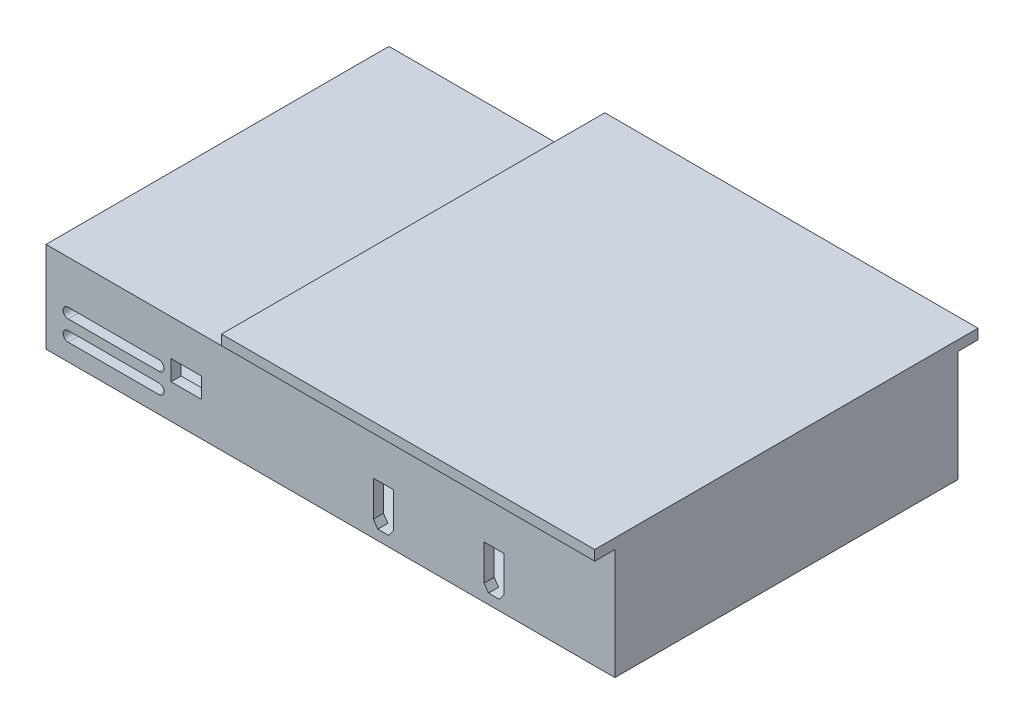
from build123d import *

# Parameters (mm, degrees)
SKETCH1_W           = 282
SKETCH1_H           = 170
BOSS_EXTRUDE1_DEPTH = 60
CUT_EXTRUDE4_DEPTH  = 5
SKETCH8_W           = 160
SKETCH8_H           = 50
CUT_EXTRUDE5_DEPTH  = 279
CUT_EXTRUDE6_DEPTH  = 5
SKETCH10_R          = 5
CUT_EXTRUDE7_DEPTH  = 5
CUT_EXTRUDE8_DEPTH  = 5
CUT_EXTRUDE9_START  = -5
CUT_EXTRUDE9_DEPTH  = 5
SKETCH14_W          = 185
SKETCH14_H          = 5
BOSS_EXTRUDE2_DEPTH = 10
SKETCH15_W          = 185
SKETCH15_H          = 5
BOSS_EXTRUDE3_DEPTH = 10
SKETCH16_W          = 97
SKETCH16_H          = 15
CUT_EXTRUDE10_DEPTH = 170
BOSS_EXTRUDE4_DEPTH = 160
SKETCH18_W          = 15
SKETCH18_H          = 10
CUT_EXTRUDE11_DEPTH = 340.888216918
BOSS_EXTRUDE5_REACH = 339.267
SKETCH19_W          = 5
SKETCH19_H          = 50


with BuildPart() as part:
    # Sketch1 → Boss-Extrude1 (new body)
    with BuildSketch(Plane(origin=(0, 0, 0), x_dir=(1, 0, 0), z_dir=(0, 1, 0))):
        with Locations((141, 85)):
            Rectangle(SKETCH1_W, SKETCH1_H)
    extrude(amount=BOSS_EXTRUDE1_DEPTH)

    # Sketch7 → Cut-Extrude4 (cut)
    with BuildSketch(Plane.XZ):
        with BuildLine():
            Line((13.5, -37.5), (13.5, -132.5))
            ThreePointArc((13.5, -132.5), (11, -135), (8.5, -132.5))
            Line((8.5, -132.5), (8.5, -37.5))
            ThreePointArc((8.5, -37.5), (11, -35), (13.5, -37.5))
        make_face()
        with BuildLine():
            Line((58.5, -37.5), (58.5, -132.5))
            ThreePointArc((58.5, -132.5), (56, -135), (53.5, -132.5))
            Line((53.5, -132.5), (53.5, -37.5))
            ThreePointArc((53.5, -37.5), (56, -35), (58.5, -37.5))
        make_face()
        with BuildLine():
            Line((28.5, -37.5), (28.5, -132.5))
            ThreePointArc((28.5, -132.5), (26, -135), (23.5, -132.5))
            Line((23.5, -132.5), (23.5, -37.5))
            ThreePointArc((23.5, -37.5), (26, -35), (28.5, -37.5))
        make_face()
        with BuildLine():
            Line((43.5, -37.5), (43.5, -132.5))
            ThreePointArc((43.5, -132.5), (41, -135), (38.5, -132.5))
            Line((38.5, -132.5), (38.5, -37.5))
            ThreePointArc((38.5, -37.5), (41, -35), (43.5, -37.5))
        make_face()
    extrude(amount=-CUT_EXTRUDE4_DEPTH, mode=Mode.SUBTRACT)

    # Sketch8 → Cut-Extrude5 (cut)
    with BuildSketch(Plane(origin=(282, 0, 0), x_dir=(0, 0, -1), z_dir=(1, 0, 0))):
        with Locations((85, 30)):
            Rectangle(SKETCH8_W, SKETCH8_H)
    extrude(amount=-CUT_EXTRUDE5_DEPTH, mode=Mode.SUBTRACT)

    # Sketch9 → Cut-Extrude6 (cut)
    with BuildSketch(Plane.XY):
        Polygon((217.15, 25.8), (227.05, 25.8), (227.05, 8.15), (224.8, 5), (219.4, 5), (217.15, 8.15), align=None)
        Polygon((162.25, 25.8), (172.15, 25.8), (172.15, 8.15), (169.9, 5), (164.5, 5), (162.25, 8.15), align=None)
    extrude(amount=-CUT_EXTRUDE6_DEPTH, mode=Mode.SUBTRACT)

    # Sketch10 → Cut-Extrude7 (cut)
    with BuildSketch(Plane.ZY):
        with Locations((-129.202249563, 20)):
            Circle(SKETCH10_R)
        with Locations((-114.202249563, 20)):
            Circle(SKETCH10_R)
        with Locations((-99.202249563, 20)):
            Circle(SKETCH10_R)
        with Locations((-43.390057257, 20)):
            Circle(SKETCH10_R)
        with Locations((-58.390057257, 20)):
            Circle(SKETCH10_R)
        with Locations((-73.390057257, 20)):
            Circle(SKETCH10_R)
    extrude(amount=-CUT_EXTRUDE7_DEPTH, mode=Mode.SUBTRACT)

    # Sketch11 → Cut-Extrude8 (cut)
    with BuildSketch(Plane.XY):
        with BuildLine():
            Line((11, 13.5), (56, 13.5))
            ThreePointArc((56, 13.5), (58.5, 11), (56, 8.5))
            Line((56, 8.5), (11, 8.5))
            ThreePointArc((11, 8.5), (8.5, 11), (11, 13.5))
        make_face()
        with BuildLine():
            Line((11, 23.5), (56, 23.5))
            ThreePointArc((56, 23.5), (58.5, 21), (56, 18.5))
            Line((56, 18.5), (11, 18.5))
            ThreePointArc((11, 18.5), (8.5, 21), (11, 23.5))
        make_face()
    extrude(amount=-CUT_EXTRUDE8_DEPTH, mode=Mode.SUBTRACT)

    # Sketch12 → Cut-Extrude9 (cut)
    with BuildSketch(Plane(origin=(0, 0, -170), x_dir=(-1, 0, 0), z_dir=(0, 0, -1)).offset(CUT_EXTRUDE9_START)):
        with BuildLine():
            Line((-56, 13.5), (-11, 13.5))
            ThreePointArc((-11, 13.5), (-8.5, 11), (-11, 8.5))
            Line((-11, 8.5), (-56, 8.5))
            ThreePointArc((-56, 8.5), (-58.5, 11), (-56, 13.5))
        make_face()
        with BuildLine():
            Line((-56, 23.5), (-11, 23.5))
            ThreePointArc((-11, 23.5), (-8.5, 21), (-11, 18.5))
            Line((-11, 18.5), (-56, 18.5))
            ThreePointArc((-56, 18.5), (-58.5, 21), (-56, 23.5))
        make_face()
    extrude(amount=CUT_EXTRUDE9_DEPTH, mode=Mode.SUBTRACT)

    # Sketch14 → Boss-Extrude2 (add)
    with BuildSketch(Plane.XY):
        with Locations((189.5, 57.5)):
            Rectangle(SKETCH14_W, SKETCH14_H)
    extrude(amount=BOSS_EXTRUDE2_DEPTH)

    # Sketch15 → Boss-Extrude3 (add)
    with BuildSketch(Plane(origin=(0, 0, -170), x_dir=(-1, 0, 0), z_dir=(0, 0, -1))):
        with Locations((-189.5, 57.5)):
            Rectangle(SKETCH15_W, SKETCH15_H)
    extrude(amount=BOSS_EXTRUDE3_DEPTH)

    # Sketch16 → Cut-Extrude10 (cut)
    with BuildSketch(Plane.XY):
        with Locations((48.5, 52.5)):
            Rectangle(SKETCH16_W, SKETCH16_H)
    extrude(amount=-CUT_EXTRUDE10_DEPTH, mode=Mode.SUBTRACT)

    # Sketch17 → Boss-Extrude4 (add)
    with BuildSketch(Plane.XY.offset(-165)):
        Polygon((3, 45), (97, 45), (97, 55), (102, 55), (102, 40), (3, 40), align=None)
    extrude(amount=BOSS_EXTRUDE4_DEPTH)

    # Sketch18 → Cut-Extrude11 (cut, through all)
    with BuildSketch(Plane.XY):
        with Locations((69.5, 22)):
            Rectangle(SKETCH18_W, SKETCH18_H)
    extrude(amount=-CUT_EXTRUDE11_DEPTH, mode=Mode.SUBTRACT)

    # Sketch19 → Boss-Extrude5 (add, up to next)
    with BuildSketch(Plane.XY.offset(-165), mode=Mode.PRIVATE) as boss_extrude5_sk1:
        with Locations((279.5, 30)):
            Rectangle(SKETCH19_W, SKETCH19_H)
    boss_extrude5_tool1 = extrude(boss_extrude5_sk1.sketch, amount=BOSS_EXTRUDE5_REACH, mode=Mode.PRIVATE) - part.part
    add(boss_extrude5_tool1.solids().sort_by_distance((279.5, 30, -165))[0])


solid = part.part
